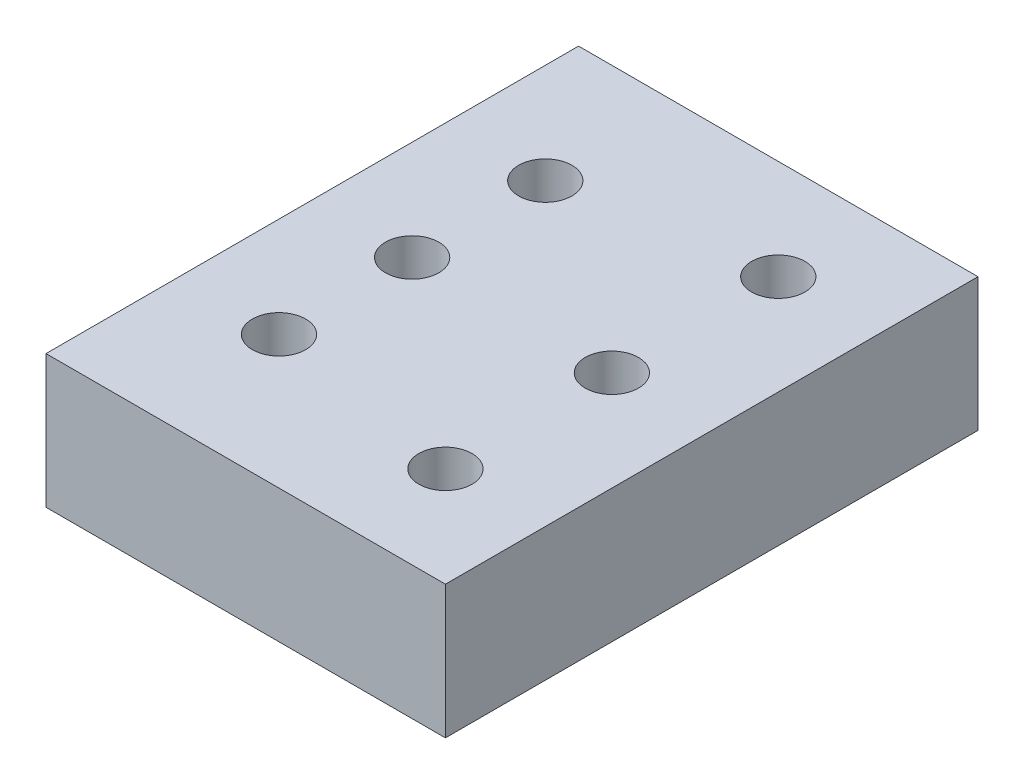
from build123d import *

# Parameters (mm, degrees)
SKETCH1_W           = 30
SKETCH1_H           = 40
SKETCH1_R           = 2
BOSS_EXTRUDE1_DEPTH = 10


with BuildPart() as part:
    # Sketch1 → Boss-Extrude1 (new body)
    with BuildSketch(Plane(origin=(0, 0, 0), x_dir=(1, 0, 0), z_dir=(0, 1, 0))):
        Rectangle(SKETCH1_W, SKETCH1_H)
        with Locations(Location((7.5, 12.5, 0), (0, 0, 270))):
            Circle(SKETCH1_R, mode=Mode.SUBTRACT)
        with Locations(Location((7.5, -12.5, 0), (0, 0, 270))):
            Circle(SKETCH1_R, mode=Mode.SUBTRACT)
        with Locations(Location((-7.5, -10, 0), (0, 0, 270))):
            Circle(SKETCH1_R, mode=Mode.SUBTRACT)
        with Locations(Location((-7.5, 10, 0), (0, 0, 270))):
            Circle(SKETCH1_R, mode=Mode.SUBTRACT)
        with Locations(Location((-7.5, 0, 0), (0, 0, 270))):
            Circle(SKETCH1_R, mode=Mode.SUBTRACT)
        with Locations(Location((7.5, 0, 0), (0, 0, 270))):
            Circle(SKETCH1_R, mode=Mode.SUBTRACT)
    extrude(amount=BOSS_EXTRUDE1_DEPTH)


solid = part.part
